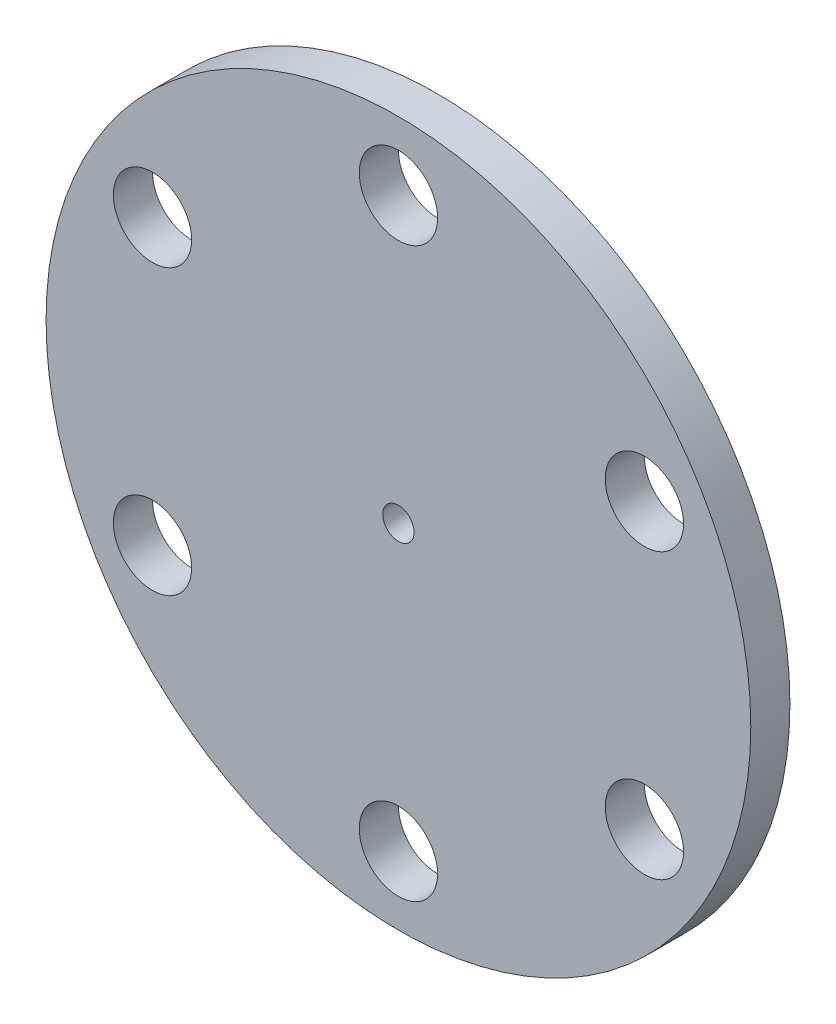
from build123d import *

# Parameters (mm, degrees)
SKETCH1_R           = 45
SKETCH1_R_2         = 5
SKETCH1_R_3         = 2
BOSS_EXTRUDE1_DEPTH = 5


with BuildPart() as part:
    # Sketch1 → Boss-Extrude1 (new body)
    with BuildSketch(Plane.XY):
        Circle(SKETCH1_R)
        with Locations((0, 36.269639471)):
            Circle(SKETCH1_R_2, mode=Mode.SUBTRACT)
        with Locations((31.410429168, 18.134819735)):
            Circle(SKETCH1_R_2, mode=Mode.SUBTRACT)
        with Locations((31.410429168, -18.134819735)):
            Circle(SKETCH1_R_2, mode=Mode.SUBTRACT)
        with Locations((0, -36.269639471)):
            Circle(SKETCH1_R_2, mode=Mode.SUBTRACT)
        with Locations((-31.410429168, -18.134819735)):
            Circle(SKETCH1_R_2, mode=Mode.SUBTRACT)
        with Locations((-31.410429168, 18.134819735)):
            Circle(SKETCH1_R_2, mode=Mode.SUBTRACT)
        Circle(SKETCH1_R_3, mode=Mode.SUBTRACT)
    extrude(amount=BOSS_EXTRUDE1_DEPTH)


solid = part.part
